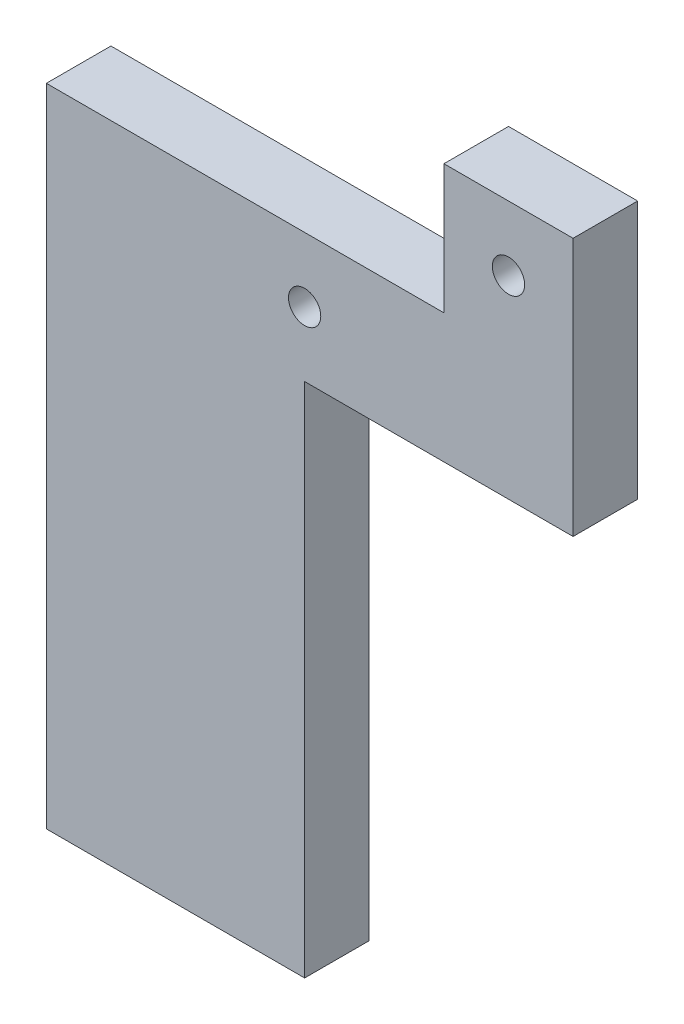
from build123d import *

# Parameters (mm, degrees)
SKETCH1_R           = 1.5875
BOSS_EXTRUDE2_DEPTH = 6.35


with BuildPart() as part:
    # Sketch1 → Boss-Extrude2 (new body)
    with BuildSketch(Plane.XY):
        Polygon((25.4, 50.8), (51.8, 50.8), (51.8, 76.2), (39.1, 76.2), (39.1, 63.5), (0, 63.5), (0, 0), (25.4, 0), align=None)
        with Locations((25.4, 57.15)):
            Circle(SKETCH1_R, mode=Mode.SUBTRACT)
        with Locations((45.45, 69.85)):
            Circle(SKETCH1_R, mode=Mode.SUBTRACT)
    extrude(amount=BOSS_EXTRUDE2_DEPTH)


solid = part.part
